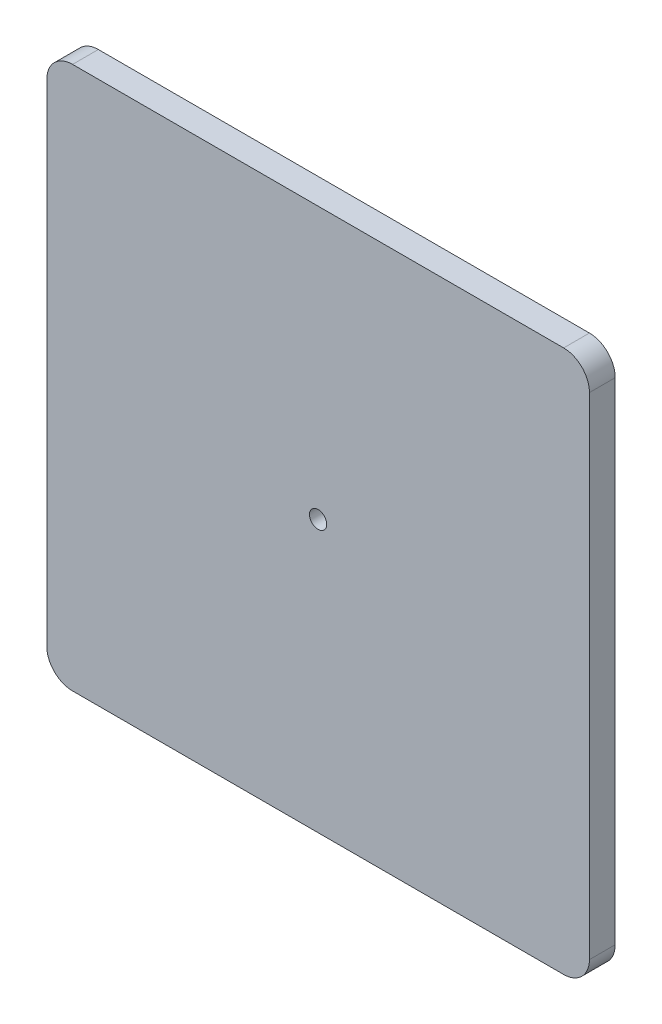
from build123d import *

# Parameters (mm, degrees)
BASEPLATE_W                      = 200
BASEPLATE_H                      = 200
BOSS_EXTRUDE1_DEPTH              = 9.5
FILLET1_R                        = 9.5
F_1_4_INCH_BOLT_HOLE_D           = 6.35
F_1_4_INCH_BOLT_HOLE_CSINK_D     = 7.62
F_1_4_INCH_BOLT_HOLE_CSINK_ANGLE = 90
F_5_32_DOWEL_HOLE_D              = 3.96875
F_5_32_DOWEL_HOLE_DEPTH          = 6
F_5_32_DOWEL_HOLE_CSINK_D        = 5.23875
F_5_32_DOWEL_HOLE_CSINK_ANGLE    = 100
F_5_32_DOWEL_HOLE_TIP            = 1.192332791


with BuildPart() as part:
    # Baseplate → Boss-Extrude1 (new body)
    with BuildSketch(Plane.XY):
        Rectangle(BASEPLATE_W, BASEPLATE_H)
    extrude(amount=BOSS_EXTRUDE1_DEPTH)

    # Fillet1
    fillet1_edges = [part.edges().sort_by_distance(p)[0] for p in [
        (100, -100, 4.75),
        (-100, -100, 4.75),
        (-100, 100, 4.75),
        (100, 100, 4.75),
    ]]
    fillet(fillet1_edges, radius=FILLET1_R)

    # 1/4 Inch Bolt Hole (through all)
    with Locations(Plane(origin=(0, 0, 0), x_dir=(-1, 0, 0), z_dir=(0, 0, -1))):
        with Locations((0, 0)):
            CounterSinkHole(F_1_4_INCH_BOLT_HOLE_D / 2, F_1_4_INCH_BOLT_HOLE_CSINK_D / 2, counter_sink_angle=F_1_4_INCH_BOLT_HOLE_CSINK_ANGLE)

    # 5/32 Dowel Hole
    with Locations(Plane(origin=(0, 0, 0), x_dir=(-1, 0, 0), z_dir=(0, 0, -1))):
        with Locations((-44.5, 0), (44.45, 0)):
            CounterSinkHole(F_5_32_DOWEL_HOLE_D / 2, F_5_32_DOWEL_HOLE_CSINK_D / 2, depth=F_5_32_DOWEL_HOLE_DEPTH, counter_sink_angle=F_5_32_DOWEL_HOLE_CSINK_ANGLE)
            with Locations((0, 0, -(F_5_32_DOWEL_HOLE_DEPTH + F_5_32_DOWEL_HOLE_TIP / 2))):  # 118° drill point
                Cone(0, F_5_32_DOWEL_HOLE_D / 2, F_5_32_DOWEL_HOLE_TIP, mode=Mode.SUBTRACT)


solid = part.part
